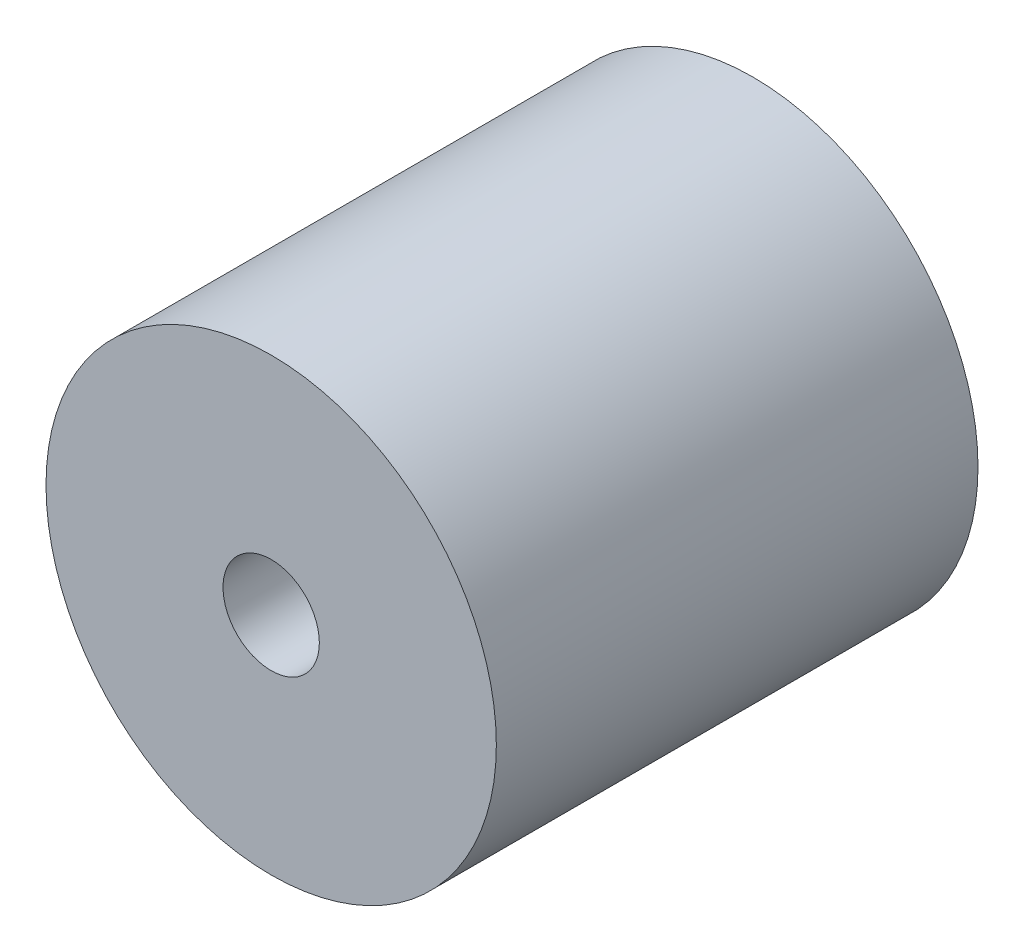
from build123d import *

# Parameters (mm, degrees)
SKETCH_1_R          = 9.35
EXTRUDE_1_DEPTH     = 20
SKETCH_5_R          = 2
CUT_EXTRUDE_2_DEPTH = 20


with BuildPart() as part:
    # 草图1 → 凸台-拉伸1 (new body)
    with BuildSketch(Plane.XY):
        Circle(SKETCH_1_R)
    extrude(amount=EXTRUDE_1_DEPTH)

    # 草图5 → 切除-拉伸2 (cut)
    with BuildSketch(Plane.XY.offset(20)):
        Circle(SKETCH_5_R)
    extrude(amount=-CUT_EXTRUDE_2_DEPTH, mode=Mode.SUBTRACT)


solid = part.part
